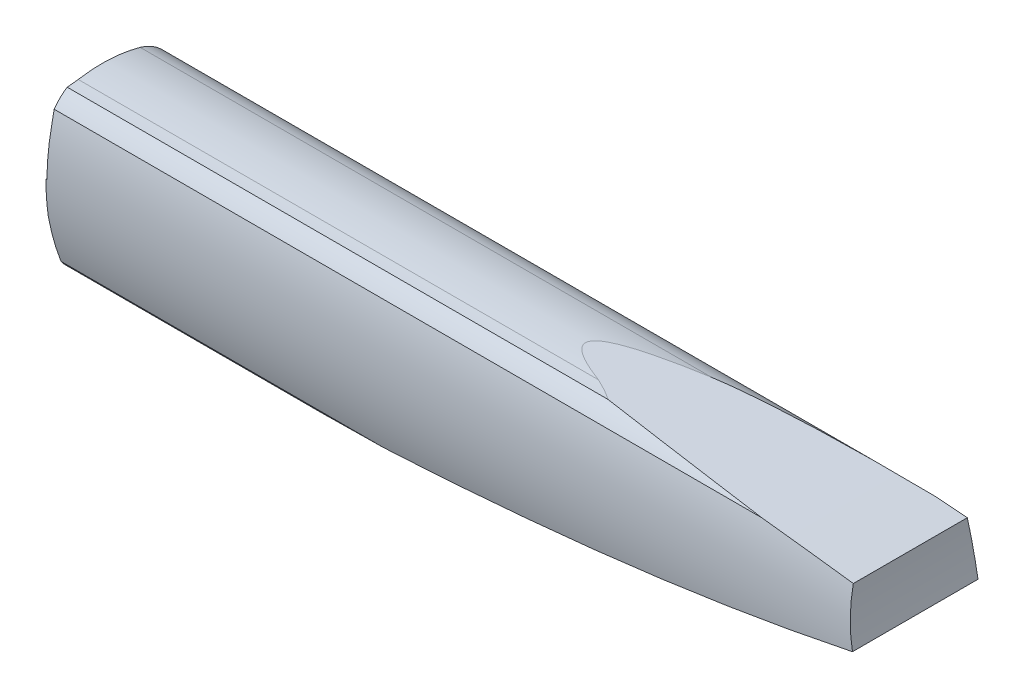
from build123d import *

# Parameters (mm, degrees)
BOSS_EXTRUDE1_DEPTH     = 100
CUT_EXTRUDE3_DEPTH      = 554.165701555
CUT_EXTRUDE3_DEPTH_BACK = 554.165701555
CUT_EXTRUDE5_DEPTH      = 553.962044682
CUT_EXTRUDE5_DEPTH_BACK = 553.962044682
CUT_EXTRUDE7_DEPTH      = 553.962044682
CUT_EXTRUDE7_DEPTH_BACK = 553.962044682
CUT_EXTRUDE9_DEPTH      = 553.962044682
CUT_EXTRUDE9_DEPTH_BACK = 553.962044682


with BuildPart() as part:
    # Sketch1 → Boss-Extrude1 (new body)
    with BuildSketch(Plane.XY):
        with BuildLine():
            ThreePointArc((-192.629438793, 0), (-136.135725272, 33.719619965), (-73.991525193, 55.321722514))
            ThreePointArc((-73.991525193, 55.321722514), (231.264395529, 54.89097703), (535.785554592, 33.719619965))
            ThreePointArc((535.785554592, 33.719619965), (536.798211586, 12.89819156), (539.317827414, -7.795017256))
            ThreePointArc((539.317827414, -7.795017256), (238.042039648, -55.533392614), (-66.568309368, -71.614065728))
            ThreePointArc((-66.568309368, -71.614065728), (-137.800866021, -50.244872094), (-192.629438793, 0))
        make_face()
    extrude(amount=BOSS_EXTRUDE1_DEPTH)

    # Sketch2 → Cut-Extrude3 (cut, two sides: drawn at the far end of the back side and taken through both)
    with BuildSketch(Plane(origin=(0, 0, 0), x_dir=(0, 0, -1), z_dir=(1, 0, 0)).offset(-CUT_EXTRUDE3_DEPTH_BACK)):
        with BuildLine():
            ThreePointArc((-65.447202994, 54.830423707), (-80.892507985, 50.983746932), (-92.956496986, 40.600368972))
            ThreePointArc((-92.956496986, 40.600368972), (-98.736407831, -10.977338679), (-88.967303886, -61.950193259))
            ThreePointArc((-88.967303886, -61.950193259), (-83.10915251, -68.165990231), (-75.589128758, -72.216090516))
            ThreePointArc((-75.589128758, -72.216090516), (-123.822815089, -94.064788666), (-173.378544397, -75.407784602))
            ThreePointArc((-173.378544397, -75.407784602), (-163.802190068, -4.583325871), (-135.262897635, 60.940099743))
            ThreePointArc((-135.262897635, 60.940099743), (-100.366866686, 80.430667917), (-61.326949176, 89.003885783))
            ThreePointArc((-61.326949176, 89.003885783), (-63.560434952, 71.938056418), (-65.447202994, 54.830423707))
        make_face()
    extrude(amount=CUT_EXTRUDE3_DEPTH + CUT_EXTRUDE3_DEPTH_BACK, mode=Mode.SUBTRACT)

    # Sketch3 → Cut-Extrude5 (cut, two sides: drawn at the far end of the back side and taken through both)
    with BuildSketch(Plane(origin=(0, 0, 0), x_dir=(0, 0, -1), z_dir=(1, 0, 0)).offset(-CUT_EXTRUDE5_DEPTH_BACK)):
        with BuildLine():
            ThreePointArc((-74.208303325, 50.886642831), (-50.335012976, 52.211638999), (-26.713093985, 48.511024166))
            ThreePointArc((-26.713093985, 48.511024166), (-16.247111553, 43.841102683), (-7.714956491, 36.189482926))
            ThreePointArc((-7.714956491, 36.189482926), (-2.445034952, -12.786836037), (-8.678058045, -61.649923489))
            ThreePointArc((-8.678058045, -61.649923489), (-17.453523943, -70.69509128), (-29.511303704, -74.360307413))
            ThreePointArc((-29.511303704, -74.360307413), (33.955140221, -79.826327987), (85.286434054, -42.104117568))
            ThreePointArc((85.286434054, -42.104117568), (41.180066923, 16.064388488), (12.319514625, 83.116720583))
            ThreePointArc((12.319514625, 83.116720583), (-170.558095104, 441.821406771), (-74.208303325, 50.886642831))
        make_face()
    extrude(amount=CUT_EXTRUDE5_DEPTH + CUT_EXTRUDE5_DEPTH_BACK, mode=Mode.SUBTRACT)

    # Sketch4 → Cut-Extrude7 (cut, two sides: drawn at the far end of the back side and taken through both)
    with BuildSketch(Plane.XY.offset(-CUT_EXTRUDE7_DEPTH_BACK)):
        Polygon((-79.201401397, 32.882000093), (-79.201401397, -3.122719846), (-222.768125928, 1.814195624), (-233.222282556, 17.110218535), (-80.529357675, 72.456896947), align=None)
    extrude(amount=CUT_EXTRUDE7_DEPTH + CUT_EXTRUDE7_DEPTH_BACK, mode=Mode.SUBTRACT)

    # Sketch7 → Cut-Extrude9 (cut, two sides: drawn at the far end of the back side and taken through both)
    with BuildSketch(Plane.XY.offset(-CUT_EXTRUDE9_DEPTH_BACK)):
        Polygon((-77.622682663, -75.13174066), (-79.880490969, -28.10031394), (-79.880490969, 8.416039234), (-244.452163016, 8.416039234), (-180.732611766, -79.468551396), (-149.591071412, -109.159665737), align=None)
    extrude(amount=CUT_EXTRUDE9_DEPTH + CUT_EXTRUDE9_DEPTH_BACK, mode=Mode.SUBTRACT)


solid = part.part
